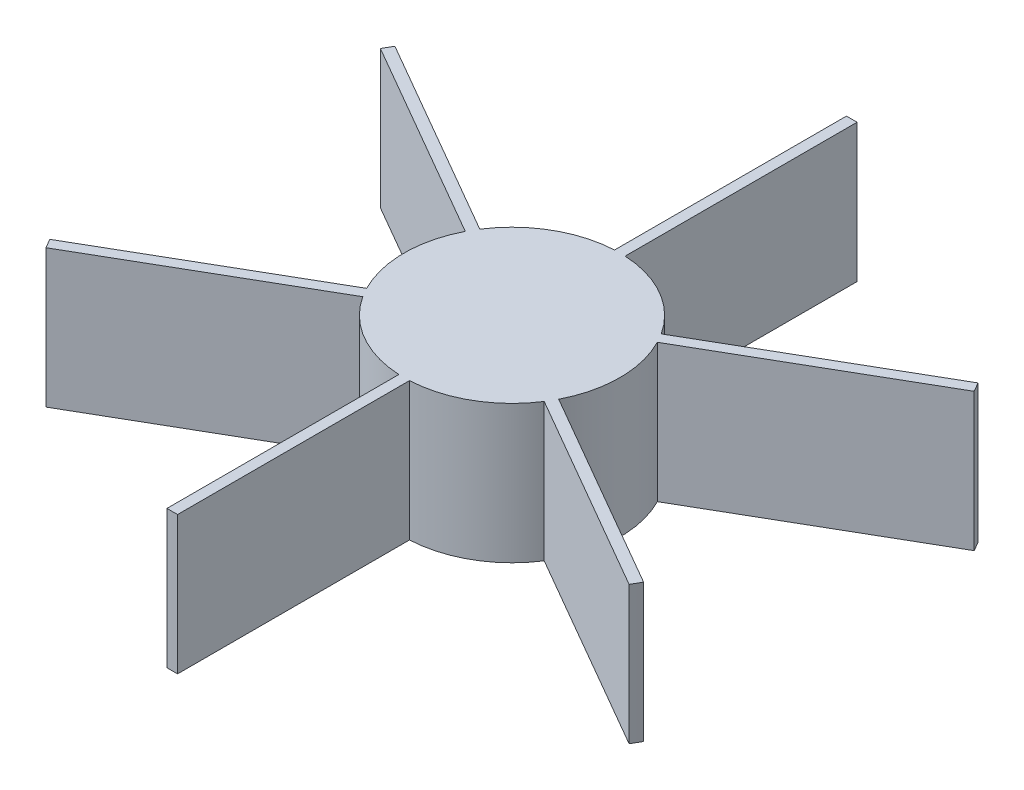
from build123d import *

# Parameters (mm, degrees)
SKETCH_1_R          = 20.5
EXTRUDE_1_DEPTH     = 40
SKETCH_2_R          = 21
EXTRUDE_2_DEPTH     = 35
SKETCH_4_R          = 20.75
CUT_EXTRUDE_2_DEPTH = 28.5
CUT_EXTRUDE_3_DEPTH = 17
EXTRUDE_START       = -40
SKETCH_7_R          = 30.5
SKETCH_7_R_2        = 24.5
EXTRUDE_4_DEPTH     = 40
SKETCH_8_R          = 27
SKETCH_8_R_2        = 20.75
CUT_EXTRUDE_4_DEPTH = 30
SKETCH_9_R          = 20.5
EXTRUDE_5_DEPTH     = 5
SKETCH_11_R         = 155.050037834
CUT_EXTRUDE_5_DEPTH = 1


with BuildPart() as part:
    # 草图1 → 凸台-拉伸1 (new body)
    with BuildSketch(Plane(origin=(0, 0, 0), x_dir=(1, 0, 0), z_dir=(0, 1, 0))):
        with BuildLine():
            Line((82.378289409, -49.293178373), (20.427818585, -13.526057366))
            ThreePointArc((20.427818585, -13.526057366), (12.25, -21.217622393), (1.5, -24.454038521))
            Line((1.5, -24.454038521), (1.5, -95.988280535))
            ThreePointArc((1.5, -95.988280535), (0, -96), (-1.5, -95.988280535))
            Line((-1.5, -95.988280535), (-1.5, -24.454038521))
            ThreePointArc((-1.5, -24.454038521), (-12.25, -21.217622393), (-20.427818585, -13.526057366))
            Line((-20.427818585, -13.526057366), (-82.378289409, -49.293178373))
            ThreePointArc((-82.378289409, -49.293178373), (-83.138438763, -48), (-83.878289409, -46.695102162))
            Line((-83.878289409, -46.695102162), (-21.927818585, -10.927981155))
            ThreePointArc((-21.927818585, -10.927981155), (-24.5, 0), (-21.927818585, 10.927981155))
            Line((-21.927818585, 10.927981155), (-83.878289409, 46.695102162))
            ThreePointArc((-83.878289409, 46.695102162), (-83.138438763, 48), (-82.378289409, 49.293178373))
            Line((-82.378289409, 49.293178373), (-20.427818585, 13.526057366))
            ThreePointArc((-20.427818585, 13.526057366), (-12.25, 21.217622393), (-1.5, 24.454038521))
            Line((-1.5, 24.454038521), (-1.5, 96))
            Line((-1.5, 96), (0.874477385, 96))
            Line((0.874477385, 96), (1.5, 96))
            Line((1.5, 96), (1.5, 24.454038521))
            ThreePointArc((1.5, 24.454038521), (12.25, 21.217622393), (20.427818585, 13.526057366))
            Line((20.427818585, 13.526057366), (82.378289409, 49.293178373))
            ThreePointArc((82.378289409, 49.293178373), (83.138438763, 48), (83.878289409, 46.695102162))
            Line((83.878289409, 46.695102162), (21.927818585, 10.927981155))
            ThreePointArc((21.927818585, 10.927981155), (24.5, 0), (21.927818585, -10.927981155))
            Line((21.927818585, -10.927981155), (83.878289409, -46.695102162))
            ThreePointArc((83.878289409, -46.695102162), (83.138438763, -48), (82.378289409, -49.293178373))
        make_face()
        with Locations(Location((0, 0, 0), (0, 0, 270))):
            Circle(SKETCH_1_R, mode=Mode.SUBTRACT)
    extrude(amount=EXTRUDE_1_DEPTH)

    # 草图2 → 凸台-拉伸2 (add)
    with BuildSketch(Plane.XZ):
        Circle(SKETCH_2_R)
    extrude(amount=-EXTRUDE_2_DEPTH)

    # 草图4 → 切除-拉伸2 (cut)
    with BuildSketch(Plane.XZ):
        with Locations(Location((0, 0, 0), (0, 0, 270))):
            Circle(SKETCH_4_R)
    extrude(amount=-CUT_EXTRUDE_2_DEPTH, mode=Mode.SUBTRACT)

    # 草图6 → 切除-拉伸3 (cut)
    with BuildSketch(Plane.XZ.offset(-28.5)):
        with BuildLine():
            Line((-6.4, 1.95), (-2.9, 1.95))
            Line((-2.9, 1.95), (-2.1, 14.9))
            ThreePointArc((-2.1, 14.9), (0, 17), (2.1, 14.9))
            Line((2.1, 14.9), (2.9, 1.95))
            Line((2.9, 1.95), (6.4, 1.95))
            ThreePointArc((6.4, 1.95), (8.35, 0), (6.4, -1.95))
            Line((6.4, -1.95), (3.5, -1.95))
            Line((3.5, -1.95), (2.1, -17.9))
            ThreePointArc((2.1, -17.9), (0, -20), (-2.1, -17.9))
            Line((-2.1, -17.9), (-3.5, -1.95))
            Line((-3.5, -1.95), (-6.4, -1.95))
            ThreePointArc((-6.4, -1.95), (-8.35, 0), (-6.4, 1.95))
        make_face()
    extrude(amount=-CUT_EXTRUDE_3_DEPTH, mode=Mode.SUBTRACT)

    # 草图7 → 凸台-拉伸4 (add)
    with BuildSketch(Plane(origin=(0, 40, 0), x_dir=(1, 0, 0), z_dir=(0, 1, 0)).offset(EXTRUDE_START)):
        Circle(SKETCH_7_R)
        Circle(SKETCH_7_R_2, mode=Mode.SUBTRACT)
    extrude(amount=EXTRUDE_4_DEPTH)

    # 草图8 → 切除-拉伸4 (cut)
    with BuildSketch(Plane.XZ):
        with Locations(Location((0, 0, 0), (0, 0, 270))):
            Circle(SKETCH_8_R)
        with Locations(Location((0, 0, 0), (0, 0, 270))):
            Circle(SKETCH_8_R_2, mode=Mode.SUBTRACT)
    extrude(amount=-CUT_EXTRUDE_4_DEPTH, mode=Mode.SUBTRACT)

    # 草图9 → 凸台-拉伸5 (add)
    with BuildSketch(Plane(origin=(0, 35, 0), x_dir=(1, 0, 0), z_dir=(0, 1, 0))):
        Circle(SKETCH_9_R)
    extrude(amount=EXTRUDE_5_DEPTH)

    # 草图11 → 切除-拉伸5 (cut)
    with BuildSketch(Plane.XZ):
        Circle(SKETCH_11_R)
    extrude(amount=-CUT_EXTRUDE_5_DEPTH, mode=Mode.SUBTRACT)


solid = part.part
